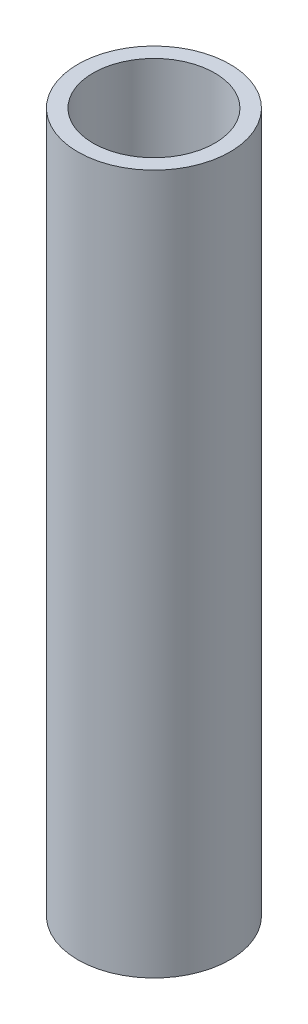
from build123d import *

# Parameters (mm, degrees)
SKETCH1_R           = 15.875
SKETCH1_R_2         = 12.7
BOSS_EXTRUDE1_DEPTH = 73.025


with BuildPart() as part:
    # Sketch1 → Boss-Extrude1 (new, symmetric)
    with BuildSketch(Plane(origin=(0, 0, 0), x_dir=(1, 0, 0), z_dir=(0, 1, 0))):
        with Locations(Location((0, 0, 0), (0, 0, 270))):
            Circle(SKETCH1_R)
        with Locations(Location((0, 0, 0), (0, 0, 270))):
            Circle(SKETCH1_R_2, mode=Mode.SUBTRACT)
    extrude(amount=BOSS_EXTRUDE1_DEPTH, both=True)


solid = part.part
